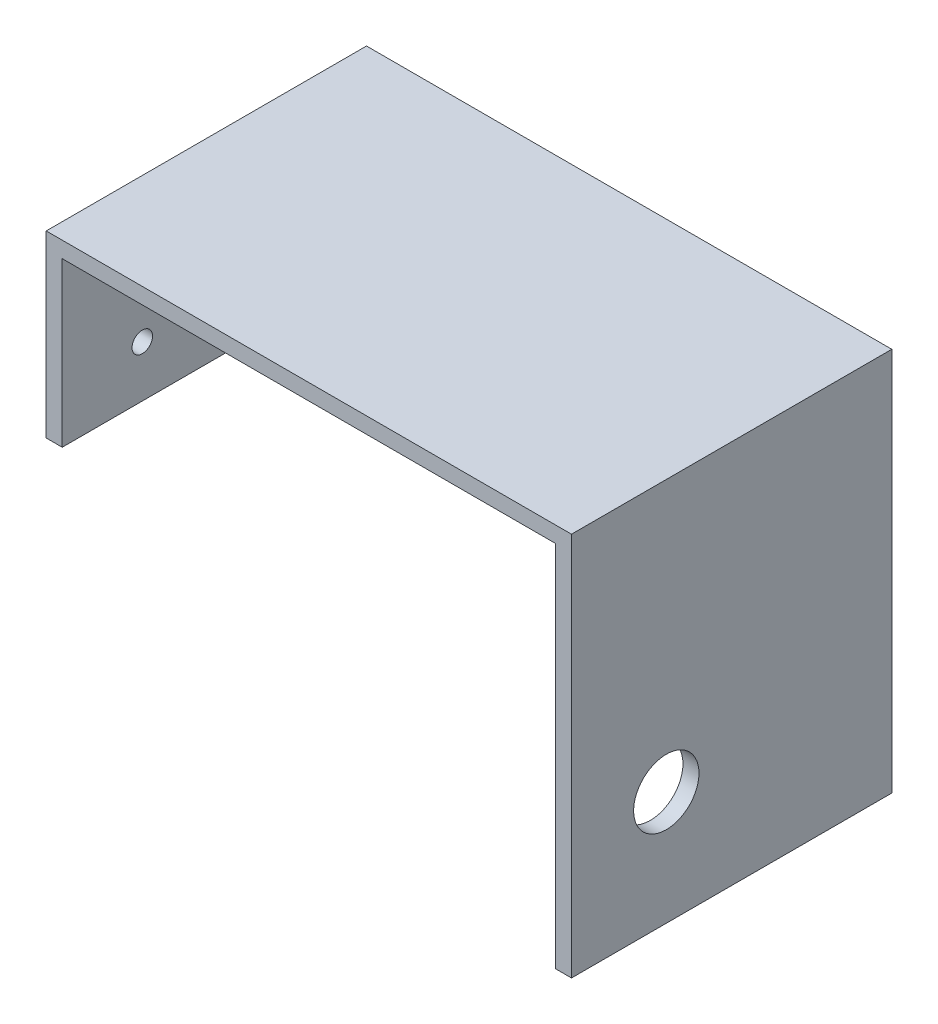
from build123d import *

# Parameters (mm, degrees)
BOSS_EXTRUDE1_DEPTH = 50
SKETCH3_R           = 1.6
CUT_EXTRUDE1_DEPTH  = 50
SKETCH4_R           = 5.1
CUT_EXTRUDE2_DEPTH  = 50


with BuildPart() as part:
    # Sketch2 → Boss-Extrude1 (new body)
    with BuildSketch(Plane.XY):
        Polygon((0, 0), (-82, 0), (-82, -28), (-79.5, -28), (-79.5, -2.5), (-2.5, -2.5), (-2.5, -60), (0, -60), align=None)
    extrude(amount=BOSS_EXTRUDE1_DEPTH)

    # Sketch3 → Cut-Extrude1 (cut)
    with BuildSketch(Plane.ZY.offset(82)):
        with Locations((12.5, -20)):
            Circle(SKETCH3_R)
        with Locations((37.5, -20)):
            Circle(SKETCH3_R)
    extrude(amount=-CUT_EXTRUDE1_DEPTH, mode=Mode.SUBTRACT)

    # Sketch4 → Cut-Extrude2 (cut)
    with BuildSketch(Plane(origin=(0, 0, 0), x_dir=(0, 0, -1), z_dir=(1, 0, 0))):
        with Locations((-35.2, -42.25)):
            Circle(SKETCH4_R)
    extrude(amount=-CUT_EXTRUDE2_DEPTH, mode=Mode.SUBTRACT)


solid = part.part
